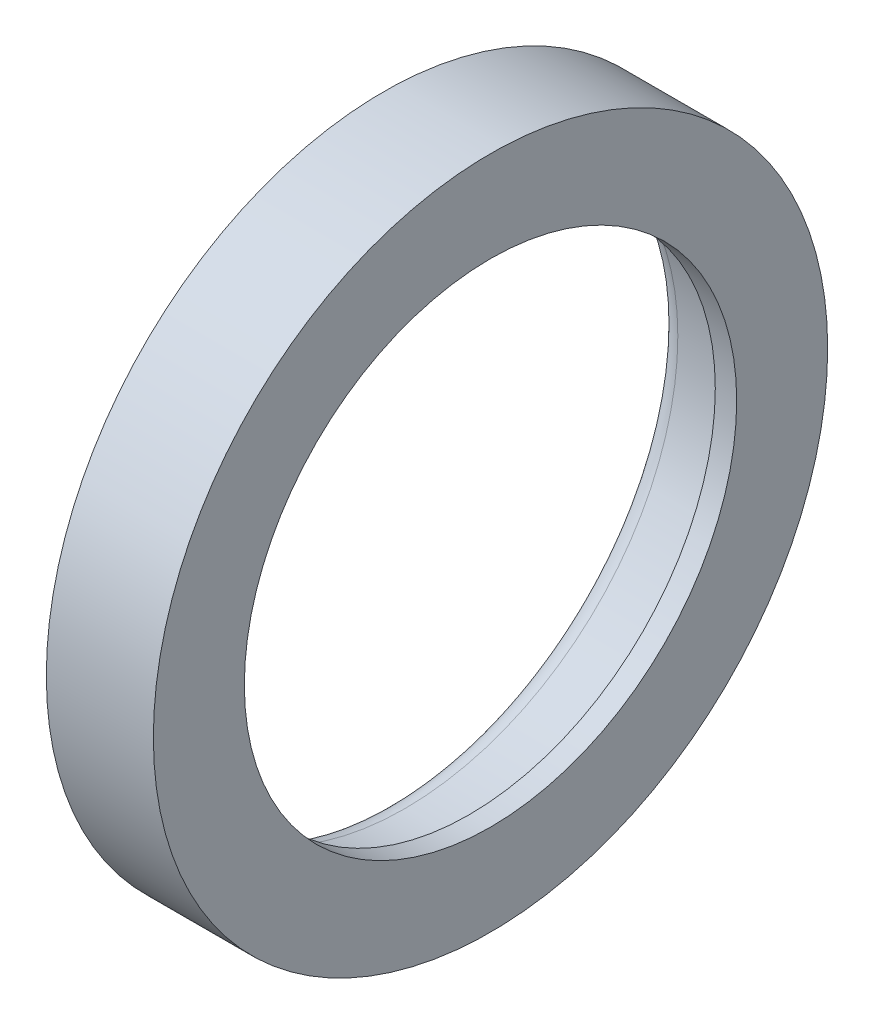
from build123d import *

# Parameters (mm, degrees)
SKETCH1_R            = 15.75
SKETCH1_R_2          = 12.75
BOSS_EXTRUDE1_DEPTH  = 5
FILLET3_R            = 1
SKETCH1_3_R          = 12.75
SKETCH1_3_R_2        = 11.5
BOSS_EXTRUDE29_DEPTH = 1


with BuildPart() as part:
    # Sketch1 → Boss-Extrude1 (new body)
    with BuildSketch(Plane(origin=(0, 0, 0), x_dir=(0, 0, -1), z_dir=(1, 0, 0))):
        Circle(SKETCH1_R)
        Circle(SKETCH1_R_2, mode=Mode.SUBTRACT)
    extrude(amount=-BOSS_EXTRUDE1_DEPTH)

    # Fillet3
    fillet3_edges = [part.edges().sort_by_distance(p)[0] for p in [
        (-5, 0, 12.75),
    ]]
    fillet(fillet3_edges, radius=FILLET3_R)

    # Sketch1<3> → Boss-Extrude29 (add)
    with BuildSketch(Plane(origin=(0, 0, 0), x_dir=(0, 0, -1), z_dir=(1, 0, 0))):
        Circle(SKETCH1_3_R)
        Circle(SKETCH1_3_R_2, mode=Mode.SUBTRACT)
    extrude(amount=-BOSS_EXTRUDE29_DEPTH)


solid = part.part
